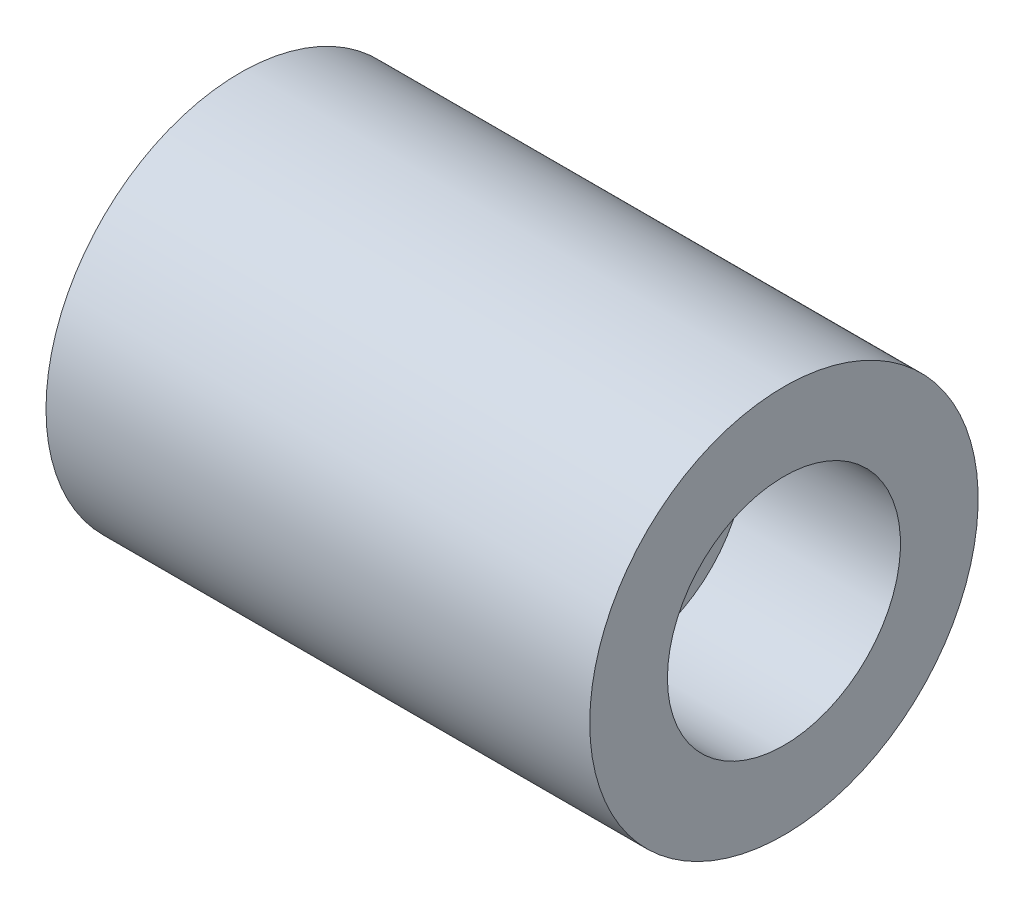
from build123d import *


with BuildPart() as part:
    # Sketch1 → Revolve1 (revolve)
    with BuildSketch(Plane.XY, mode=Mode.PRIVATE) as revolve1_sk:
        Polygon((0, 50), (0, 30), (-40, 30), (-40, 10), (-120, 10), (-120, 0), (-140, 0), (-140, 50), align=None)
    revolve(revolve1_sk.sketch.rotate(Axis((-205.277081619, 0, 0), (1, 0, 0)), 90), axis=Axis((-205.277081619, 0, 0), (1, 0, 0)))


solid = part.part
